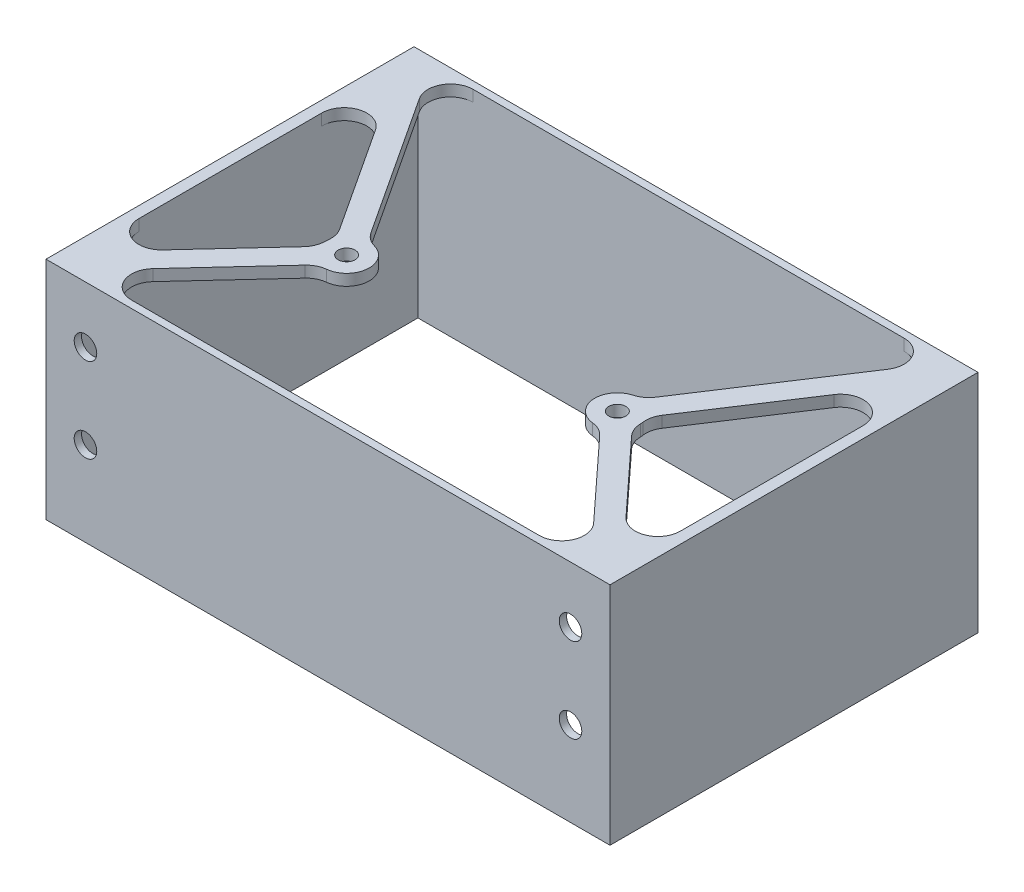
from build123d import *

# Parameters (mm, degrees)
SKETCH1_W             = 100
SKETCH1_H             = 65.25
SKETCH1_W_2           = 96
SKETCH1_H_2           = 62.64
BOSS_EXTRUDE1_DEPTH   = 40
CUT_EXTRUDE1_REACH    = 93.42
SKETCH2_R             = 2
SKETCH3_R             = 4
SKETCH3_R_2           = 1.5
BOSS_EXTRUDE2_DEPTH   = 2
BOSS_EXTRUDE2_2_DEPTH = 2
BOSS_EXTRUDE4_DEPTH   = 2
FILLET1_R             = 4


with BuildPart() as part:
    # Sketch1 → Boss-Extrude1 (new body)
    with BuildSketch(Plane(origin=(0, 0, 0), x_dir=(1, 0, 0), z_dir=(0, 1, 0))):
        Rectangle(SKETCH1_W, SKETCH1_H)
        Rectangle(SKETCH1_W_2, SKETCH1_H_2, mode=Mode.SUBTRACT)
    extrude(amount=BOSS_EXTRUDE1_DEPTH)

    # Sketch2 → Cut-Extrude1 (cut, up to next)
    with BuildSketch(Plane.XY.offset(32.625), mode=Mode.PRIVATE) as cut_extrude1_sk1:
        with Locations((-43, 15)):
            Circle(SKETCH2_R)
    cut_extrude1_tool1 = extrude(cut_extrude1_sk1.sketch, amount=-CUT_EXTRUDE1_REACH, mode=Mode.PRIVATE) & part.part
    # Sketch2 → Cut-Extrude1 (cut, up to next)
    with BuildSketch(Plane.XY.offset(32.625), mode=Mode.PRIVATE) as cut_extrude1_sk2:
        with Locations((-43, 30)):
            Circle(SKETCH2_R)
    cut_extrude1_tool2 = extrude(cut_extrude1_sk2.sketch, amount=-CUT_EXTRUDE1_REACH, mode=Mode.PRIVATE) & part.part
    # Sketch2 → Cut-Extrude1 (cut, up to next)
    with BuildSketch(Plane.XY.offset(32.625), mode=Mode.PRIVATE) as cut_extrude1_sk3:
        with Locations((43, 30)):
            Circle(SKETCH2_R)
    cut_extrude1_tool3 = extrude(cut_extrude1_sk3.sketch, amount=-CUT_EXTRUDE1_REACH, mode=Mode.PRIVATE) & part.part
    # Sketch2 → Cut-Extrude1 (cut, up to next)
    with BuildSketch(Plane.XY.offset(32.625), mode=Mode.PRIVATE) as cut_extrude1_sk4:
        with Locations((43, 15)):
            Circle(SKETCH2_R)
    cut_extrude1_tool4 = extrude(cut_extrude1_sk4.sketch, amount=-CUT_EXTRUDE1_REACH, mode=Mode.PRIVATE) & part.part
    add(cut_extrude1_tool1.solids().sort_by_distance((-43, 15, 32.625))[0], mode=Mode.SUBTRACT)
    add(cut_extrude1_tool2.solids().sort_by_distance((-43, 30, 32.625))[0], mode=Mode.SUBTRACT)
    add(cut_extrude1_tool3.solids().sort_by_distance((43, 30, 32.625))[0], mode=Mode.SUBTRACT)
    add(cut_extrude1_tool4.solids().sort_by_distance((43, 15, 32.625))[0], mode=Mode.SUBTRACT)



with BuildPart() as body_2:
    # Sketch3 → Boss-Extrude2 (new body)
    with BuildSketch(Plane(origin=(0, 40, 0), x_dir=(1, 0, 0), z_dir=(0, 1, 0))):
        with Locations(Location((-24, -5.32, 0), (0, 0, 270))):
            Circle(SKETCH3_R)
        with Locations(Location((-24, -5.32, 0), (0, 0, 270))):
            Circle(SKETCH3_R_2, mode=Mode.SUBTRACT)
    extrude(amount=-BOSS_EXTRUDE2_DEPTH)


with BuildPart() as body_3:
    # Sketch3 → Boss-Extrude2 2 (new body)
    with BuildSketch(Plane(origin=(0, 40, 0), x_dir=(1, 0, 0), z_dir=(0, 1, 0))):
        with Locations(Location((24, -5.32, 0), (0, 0, 270))):
            Circle(SKETCH3_R)
        with Locations(Location((24, -5.32, 0), (0, 0, 270))):
            Circle(SKETCH3_R_2, mode=Mode.SUBTRACT)
    extrude(amount=-BOSS_EXTRUDE2_2_DEPTH)


with BuildPart() as part_1:
    add(part.part)

    add(body_2.part)  # Boss-Extrude4 merges body 2

    add(body_3.part)  # Boss-Extrude4 merges body 3
    # Sketch4 → Boss-Extrude4 (add)
    with BuildSketch(Plane(origin=(0, 40, 0), x_dir=(-1, 0, 0), z_dir=(0, -1, 0))):
        with BuildLine():
            Line((-24.225075601, -1.326337399), (-45.609139399, 31.32))
            Line((-45.609139399, 31.32), (-48, 31.32))
            Line((-48, 31.32), (-48, 27.669952816))
            Line((-48, 27.669952816), (-27.571151067, -3.518089888))
            ThreePointArc((-27.571151067, -3.518089888), (-26.191752489, -1.973924534), (-24.225075601, -1.326337399))
        make_face()
        with BuildLine():
            Line((-27.819238089, -6.508873594), (-48, -28.371365665))
            Line((-48, -28.371365665), (-48, -31.32))
            Line((-48, -31.32), (-45.27818369, -31.32))
            Line((-45.27818369, -31.32), (-24.88002431, -9.221994005))
            ThreePointArc((-24.88002431, -9.221994005), (-26.713120411, -8.259213779), (-27.819238089, -6.508873594))
        make_face()
        with BuildLine():
            Line((24.225075601, -1.326337399), (45.609139399, 31.32))
            Line((45.609139399, 31.32), (48, 31.32))
            Line((48, 31.32), (48, 27.669952816))
            Line((48, 27.669952816), (27.571151067, -3.518089888))
            ThreePointArc((27.571151067, -3.518089888), (26.191752489, -1.973924534), (24.225075601, -1.326337399))
        make_face()
        with BuildLine():
            Line((48, -28.371365665), (48, -31.32))
            Line((48, -31.32), (45.27818369, -31.32))
            Line((45.27818369, -31.32), (24.88002431, -9.221994005))
            ThreePointArc((24.88002431, -9.221994005), (26.713120411, -8.259213779), (27.819238089, -6.508873594))
            Line((27.819238089, -6.508873594), (48, -28.371365665))
        make_face()
    extrude(amount=BOSS_EXTRUDE4_DEPTH)

    # Fillet1
    fillet1_edges = [part_1.edges().sort_by_distance(p)[0] for p in [
        (-24.88002431, 39, 9.221994005),
        (-27.819238089, 39, 6.508873594),
        (-48, 39, 28.371365665),
        (-45.27818369, 39, 31.32),
        (45.609139399, 39, -31.32),
        (24.225075601, 39, 1.326337399),
        (27.571151067, 39, 3.518089888),
        (48, 39, -27.669952816),
        (-27.571151067, 39, 3.518089888),
        (-24.225075601, 39, 1.326337399),
        (-45.609139399, 39, -31.32),
        (-48, 39, -27.669952816),
        (48, 39, 28.371365665),
        (27.819238089, 39, 6.508873594),
        (24.88002431, 39, 9.221994005),
        (45.27818369, 39, 31.32),
    ]]
    fillet(fillet1_edges, radius=FILLET1_R)


solid = part_1.part
